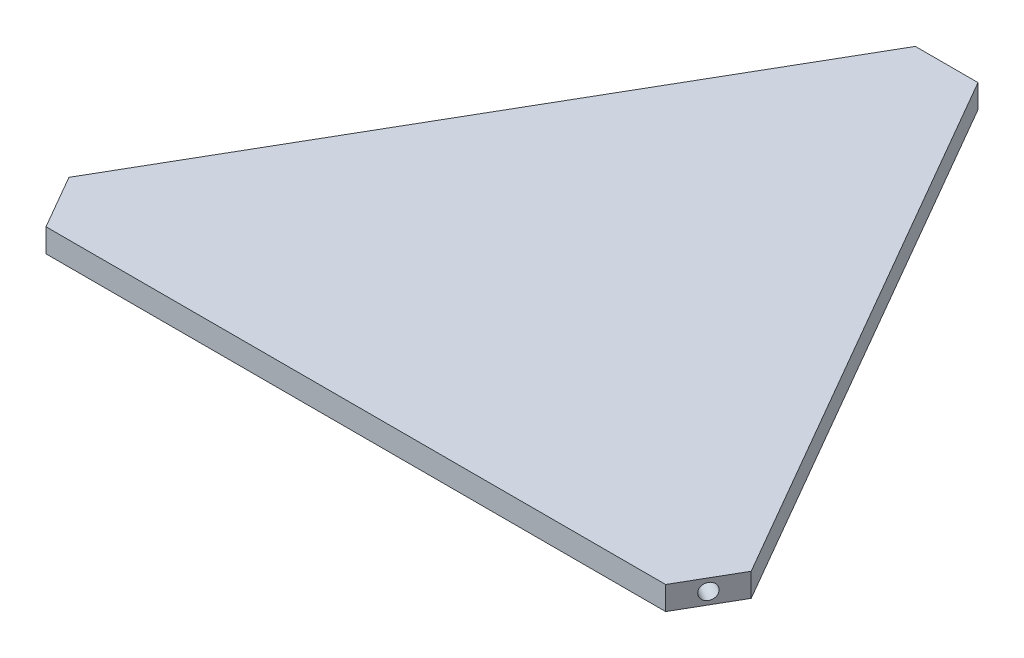
from build123d import *

# Parameters (mm, degrees)
BOSS_EXTRUDE1_DEPTH = 4.7625
CIRPATTERN1_COUNT   = 3


with BuildPart() as part:
    # Sketch1 → Boss-Extrude1 (new, symmetric)
    with BuildSketch(Plane(origin=(0, 0, 0), x_dir=(1, 0, 0), z_dir=(0, 1, 0))):
        Polygon((-12.7, 152.4), (-138.332271537, -65.201477372), (-125.632271537, -87.198522628), (125.632271537, -87.198522628), (138.332271537, -65.201477372), (12.7, 152.4), align=None)
    extrude(amount=BOSS_EXTRUDE1_DEPTH, both=True)

    # Sketch4 → 1/4 (0.25) Diameter Hole1 (revolve, cut)
    with BuildSketch(Plane(origin=(131.982271537, 0, 76.2), x_dir=(0.49999999999999806, 0, -0.8660254037844398), z_dir=(0, 1, 0))):
        Polygon((0, 0), (0, 14.607732465), (3.175, 12.7), (3.175, 0), align=None)
    f_1_4_0_25_diameter_hole1 = revolve(axis=Axis((137.481532851, 0, 79.375), (-0.8660254037844398, 0, -0.49999999999999806)), mode=Mode.SUBTRACT)

    # CirPattern1: 1/4 (0.25) Diameter Hole1 ×3 about axis
    cirpattern1_axis = Axis((0, 4.7625, 0), (0, 1, 0))
    for i in range(1, CIRPATTERN1_COUNT):
        add(f_1_4_0_25_diameter_hole1.rotate(cirpattern1_axis, i * 360 / CIRPATTERN1_COUNT), mode=Mode.SUBTRACT)


solid = part.part
